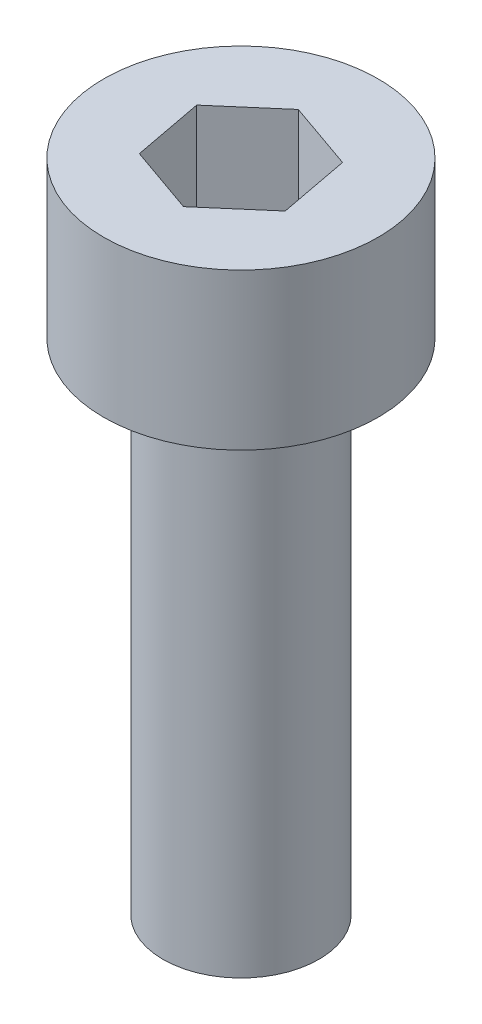
from build123d import *

# Parameters (mm, degrees)
CORTAR_EXTRUIR1_DEPTH = 2


with BuildPart() as part:
    # Croquis1 → Revolución1 (revolve)
    with BuildSketch(Plane.XY, mode=Mode.PRIVATE) as revoluci_n1_sk:
        Polygon((0, 0), (-1.25, 0), (-1.25, 8), (-2.2, 8), (-2.2, 10.5), (-0.840646635, 10.5), (-0.840646635, 8.822225361), (0, 8.822225361), align=None)
    revolve(revoluci_n1_sk.sketch.rotate(Axis((0, 8.822225361, 0), (0, -1, 0)), 270), axis=Axis((0, 8.822225361, 0), (0, -1, 0)))

    # Croquis2 → Cortar-Extruir1 (cut)
    with BuildSketch(Plane(origin=(0, 10.5, 0), x_dir=(1, 0, 0), z_dir=(0, 1, 0))):
        Polygon((0.875027781, 0.753431958), (-0.214977325, 1.134512267), (-1.090005106, 0.381080309), (-0.875027781, -0.753431958), (0.214977325, -1.134512267), (1.090005106, -0.381080309), align=None)
    extrude(amount=-CORTAR_EXTRUIR1_DEPTH, mode=Mode.SUBTRACT)


solid = part.part
